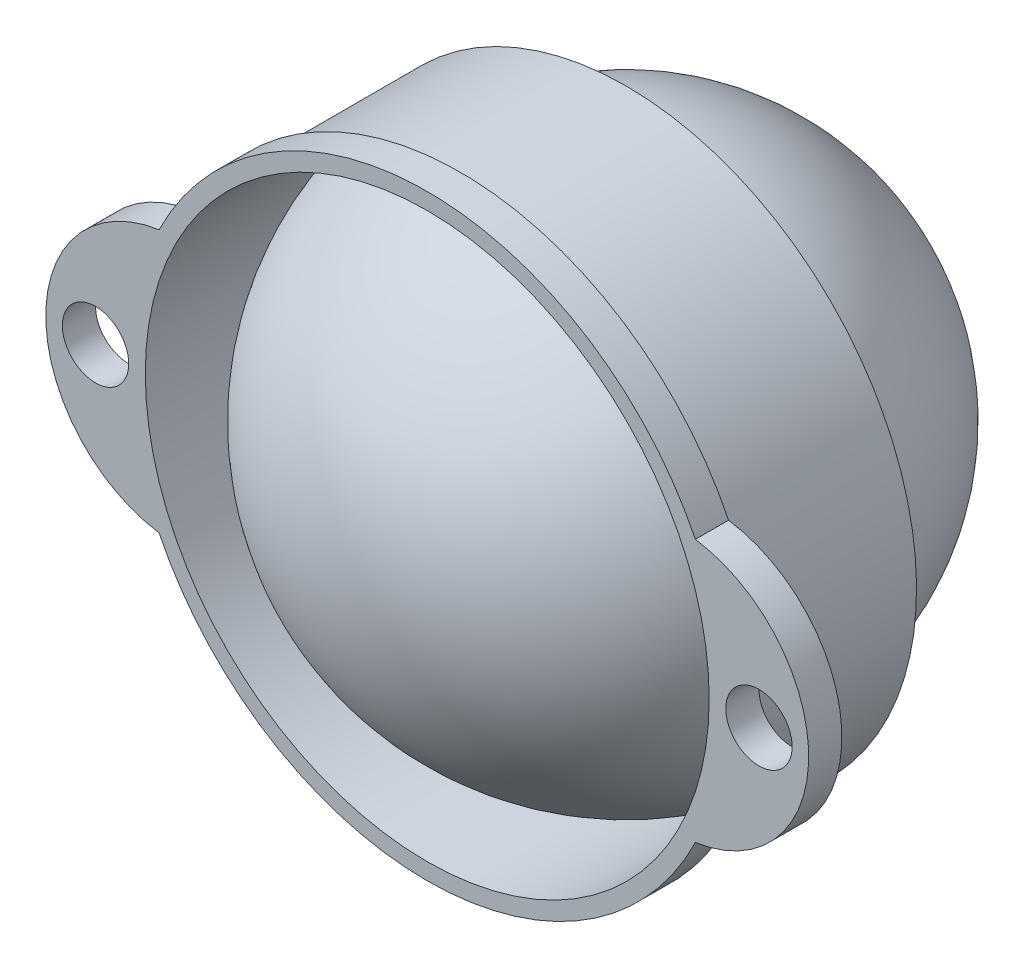
from build123d import *

# Parameters (mm, degrees)
REVOLVE5_ANGLE        = 180
SKETCH6_R             = 2
BOSS_EXTRUDE2_DEPTH   = 19
BOSS_EXTRUDE2_2_DEPTH = 19
SKETCH7_R             = 18
SKETCH7_R_2           = 17
BOSS_EXTRUDE3_DEPTH   = 19
SKETCH8_R             = 17.5
CUT_EXTRUDE5_DEPTH    = 10
SKETCH10_R            = 17.5
CUT_EXTRUDE6_DEPTH    = 7
SKETCH11_R            = 17.5
SKETCH11_R_2          = 17
CUT_EXTRUDE7_DEPTH    = 7


with BuildPart() as part:
    # Sketch1 → Revolve4 (revolve)
    with BuildSketch(Plane.XY):
        with BuildLine():
            Line((-15, 0), (15, 0))
            ThreePointArc((15, 0), (0, 15), (-15, 0))
        make_face()
    revolve(axis=Axis((-15, 0, 0), (1, 0, 0)))

    # Sketch5 → Revolve5 (revolve)
    with BuildSketch(Plane.XY):
        with BuildLine():
            Line((-17, 0), (-15, 0))
            ThreePointArc((-15, 0), (0, 15), (15, 0))
            Line((15, 0), (17, 0))
            ThreePointArc((17, 0), (0, 17), (-17, 0))
        make_face()
    revolve(axis=Axis((-17, 0, 0), (1, 0, 0)), revolution_arc=REVOLVE5_ANGLE)


with BuildPart() as body_2:
    # Sketch6 → Boss-Extrude2 (new body)
    with BuildSketch(Plane(origin=(0, 0, 0), x_dir=(-1, 0, 0), z_dir=(0, 0, -1))):
        with BuildLine():
            ThreePointArc((17, 0), (16.492938745, -4.121040105), (15.002003347, -7.996242591))
            ThreePointArc((15.002003347, -7.996242591), (20.655570006, -5.653603202), (22.9981212, 0))
            ThreePointArc((22.9981212, 0), (20.656190033, 5.656740256), (15, 8))
            ThreePointArc((15, 8), (16.492422502, 4.123105626), (17, 0))
        make_face()
        with Locations(Location((20, 0, 0), (0, 0, 90))):
            Circle(SKETCH6_R, mode=Mode.SUBTRACT)
    extrude(amount=-BOSS_EXTRUDE2_DEPTH)



with BuildPart() as body_3:
    # Sketch6 → Boss-Extrude2 2 (new body)
    with BuildSketch(Plane(origin=(0, 0, 0), x_dir=(-1, 0, 0), z_dir=(0, 0, -1))):
        with BuildLine():
            ThreePointArc((-15, 8), (-22.998121358, 0.002880253), (-15.002003347, -7.996242591))
            ThreePointArc((-15.002003347, -7.996242591), (-16.999999867, 0.002129056), (-15, 8))
        make_face()
        with Locations(Location((-20, 0, 0), (0, 0, 90))):
            Circle(SKETCH6_R, mode=Mode.SUBTRACT)
    extrude(amount=-BOSS_EXTRUDE2_2_DEPTH)


with BuildPart() as body_2_1:
    add(body_2.part)

    add(body_3.part)  # Boss-Extrude3 merges body 3
    # Sketch7 → Boss-Extrude3 (add)
    with BuildSketch(Plane.XY.offset(19)):
        Circle(SKETCH7_R)
        with Locations(Location((0, 0, 0), (0, 0, 90))):
            Circle(SKETCH7_R_2, mode=Mode.SUBTRACT)
    extrude(amount=-BOSS_EXTRUDE3_DEPTH)

    # Sketch8 → Cut-Extrude5 (cut)
    with BuildSketch(Plane(origin=(0, 0, 0), x_dir=(-1, 0, 0), z_dir=(0, 0, -1))):
        with BuildLine():
            ThreePointArc((-16.168659263, -7.910401863), (0, -18), (16.168659263, -7.910401863))
            ThreePointArc((16.168659263, -7.910401863), (22.998121358, 0.002880253), (16.166677381, 7.914451495))
            ThreePointArc((16.166677381, 7.914451495), (0, 18), (-16.166677381, 7.914451495))
            ThreePointArc((-16.166677381, 7.914451495), (-22.998121358, 0.002880253), (-16.168659263, -7.910401863))
        make_face()
        with Locations(Location((0, 0, 0), (0, 0, 90))):
            Circle(SKETCH8_R, mode=Mode.SUBTRACT)
    extrude(amount=-CUT_EXTRUDE5_DEPTH, mode=Mode.SUBTRACT)

    # Sketch10 → Cut-Extrude6 (cut)
    with BuildSketch(Plane.XY.offset(19)):
        with BuildLine():
            ThreePointArc((16.166677381, 7.914451495), (0, 18), (-16.166677381, 7.914451495))
            ThreePointArc((-16.166677381, 7.914451495), (-22.998121358, 0.002880253), (-16.168659263, -7.910401863))
            ThreePointArc((-16.168659263, -7.910401863), (0, -18), (16.168659263, -7.910401863))
            ThreePointArc((16.168659263, -7.910401863), (22.998121358, 0.002880253), (16.166677381, 7.914451495))
        make_face()
        with Locations(Location((0, 0, 0), (0, 0, 90))):
            Circle(SKETCH10_R, mode=Mode.SUBTRACT)
    extrude(amount=-CUT_EXTRUDE6_DEPTH, mode=Mode.SUBTRACT)

    # Sketch11 → Cut-Extrude7 (cut)
    with BuildSketch(Plane.XY.offset(19)):
        with Locations(Location((0, 0, 0), (0, 0, 90))):
            Circle(SKETCH11_R)
        with Locations(Location((0, 0, 0), (0, 0, 90))):
            Circle(SKETCH11_R_2, mode=Mode.SUBTRACT)
    extrude(amount=-CUT_EXTRUDE7_DEPTH, mode=Mode.SUBTRACT)


solid = Compound([part.part, body_2_1.part])
